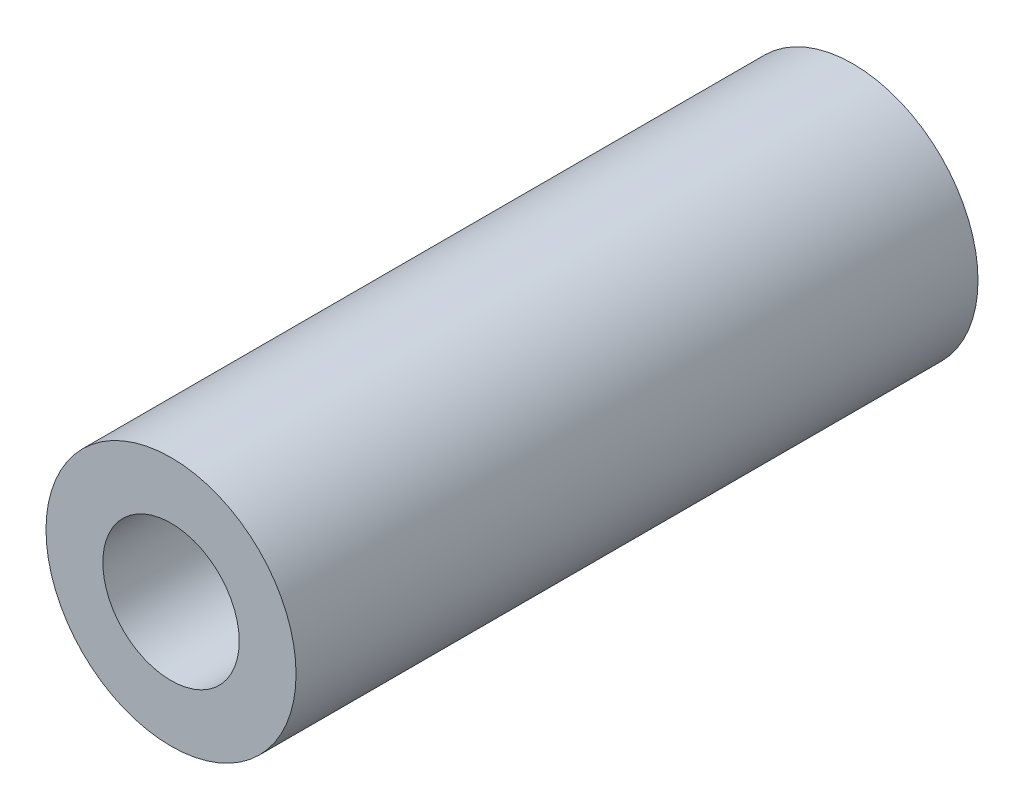
from build123d import *

# Parameters (mm, degrees)
SPOUT_SKETCH_R   = 11
SPOUT_SKETCH_R_2 = 6
SPOUT_DEPTH      = 60


with BuildPart() as part:
    # Spout Sketch → Spout (new body)
    with BuildSketch(Plane.XY):
        Circle(SPOUT_SKETCH_R)
        Circle(SPOUT_SKETCH_R_2, mode=Mode.SUBTRACT)
    extrude(amount=SPOUT_DEPTH)


solid = part.part
